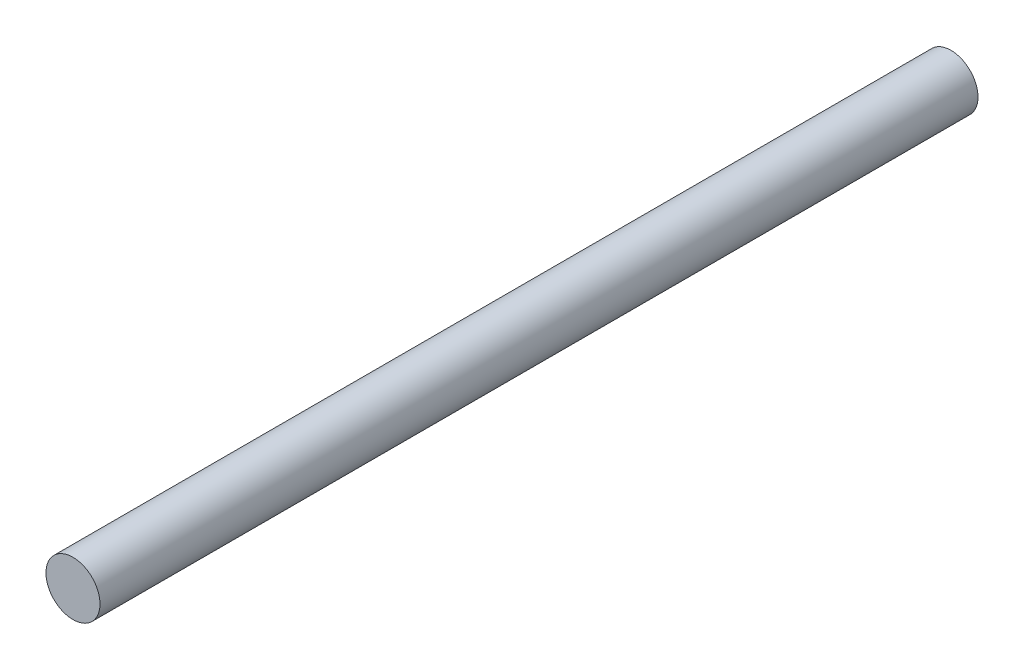
from build123d import *

# Parameters (mm, degrees)
CROQUIS1_R              = 2
SALIENTE_EXTRUIR1_DEPTH = 65


with BuildPart() as part:
    # Croquis1 → Saliente-Extruir1 (new body)
    with BuildSketch(Plane.XY):
        Circle(CROQUIS1_R)
    extrude(amount=SALIENTE_EXTRUIR1_DEPTH)


solid = part.part
